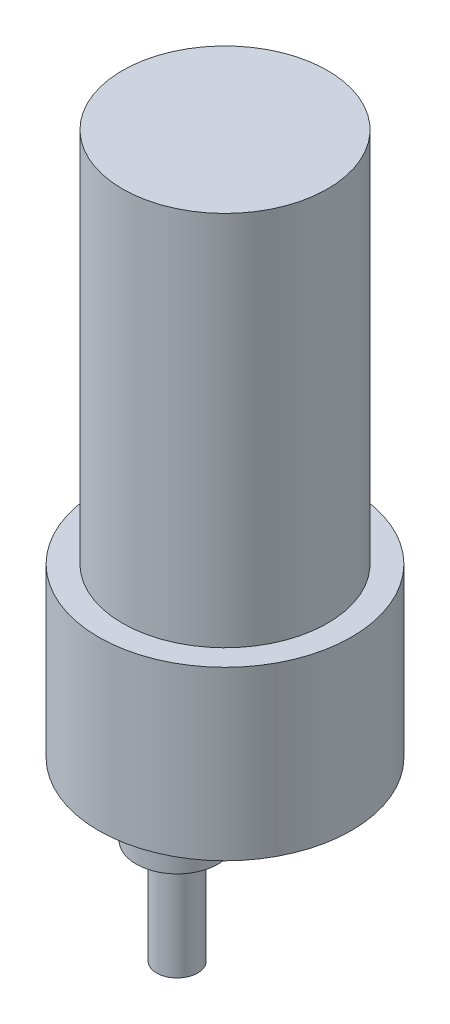
from build123d import *

# Parameters (mm, degrees)
ESQUISSE1_R                  = 18.5
BOSS_EXTRU_1_DEPTH           = 24.5
ESQUISSE2_R                  = 15
BOSS_EXTRU_2_DEPTH           = 55
ESQUISSE3_R                  = 6
BOSS_EXTRU_3_DEPTH           = 7
ESQUISSE4_R                  = 3
BOSS_EXTRU_4_DEPTH           = 15.3
ENL_V_START                  = -12
ENL_V_MAT_EXTRU_1_DEPTH      = 12
R_P_TITION_CIRCULAIRE1_COUNT = 6


with BuildPart() as part:
    # Esquisse1 → Boss.-Extru.1 (new body)
    with BuildSketch(Plane(origin=(0, 0, 0), x_dir=(1, 0, 0), z_dir=(0, 1, 0))):
        with Locations(Location((0, 0, 0), (0, 0, 270))):
            Circle(ESQUISSE1_R)
    extrude(amount=BOSS_EXTRU_1_DEPTH)

    # Esquisse2 → Boss.-Extru.2 (add)
    with BuildSketch(Plane(origin=(0, 24.5, 0), x_dir=(1, 0, 0), z_dir=(0, 1, 0))):
        with Locations(Location((0, 0, 0), (0, 0, 270))):
            Circle(ESQUISSE2_R)
    extrude(amount=BOSS_EXTRU_2_DEPTH)

    # Esquisse3 → Boss.-Extru.3 (add)
    with BuildSketch(Plane(origin=(0, 0, 0), x_dir=(1, 0, 0), z_dir=(0, 1, 0))):
        with Locations(Location((0, -7, 0), (0, 0, 270))):
            Circle(ESQUISSE3_R)
    extrude(amount=-BOSS_EXTRU_3_DEPTH)

    # Esquisse4 → Boss.-Extru.4 (add)
    with BuildSketch(Plane.XZ.offset(7)):
        with Locations(Location((0, 7, 0), (0, 0, 270))):
            Circle(ESQUISSE4_R)
    extrude(amount=BOSS_EXTRU_4_DEPTH)

    # Esquisse5 → Enlèv. mat.-Extru.1 (cut)
    with BuildSketch(Plane.XZ.offset(22.3).offset(ENL_V_START)):
        with BuildLine():
            Line((-1.731328969, 4.55), (1.731328969, 4.55))
            ThreePointArc((1.731328969, 4.55), (0, 4), (-1.731328969, 4.55))
        make_face()
    extrude(amount=ENL_V_MAT_EXTRU_1_DEPTH, mode=Mode.SUBTRACT)

    # Esquisse7 → Trou taraudé M31 (revolve, cut)
    with BuildSketch(Plane(origin=(15.5, 0, 0), x_dir=(0, 0, -1), z_dir=(1, 0, 0))):
        Polygon((0, 0), (0, 5.751075774), (1.25, 5), (1.25, 0), align=None)
    trou_taraud_m31 = revolve(axis=Axis((15.5, -6.35, 0), (0, 1, 0)), mode=Mode.SUBTRACT)

    # Répétition circulaire1: Trou taraudé M31 ×6 about axis
    r_p_tition_circulaire1_axis = Axis((0, 0, 0), (0, 1, 0))
    for i in range(1, R_P_TITION_CIRCULAIRE1_COUNT):
        add(trou_taraud_m31.rotate(r_p_tition_circulaire1_axis, i * 360 / R_P_TITION_CIRCULAIRE1_COUNT), mode=Mode.SUBTRACT)


solid = part.part
